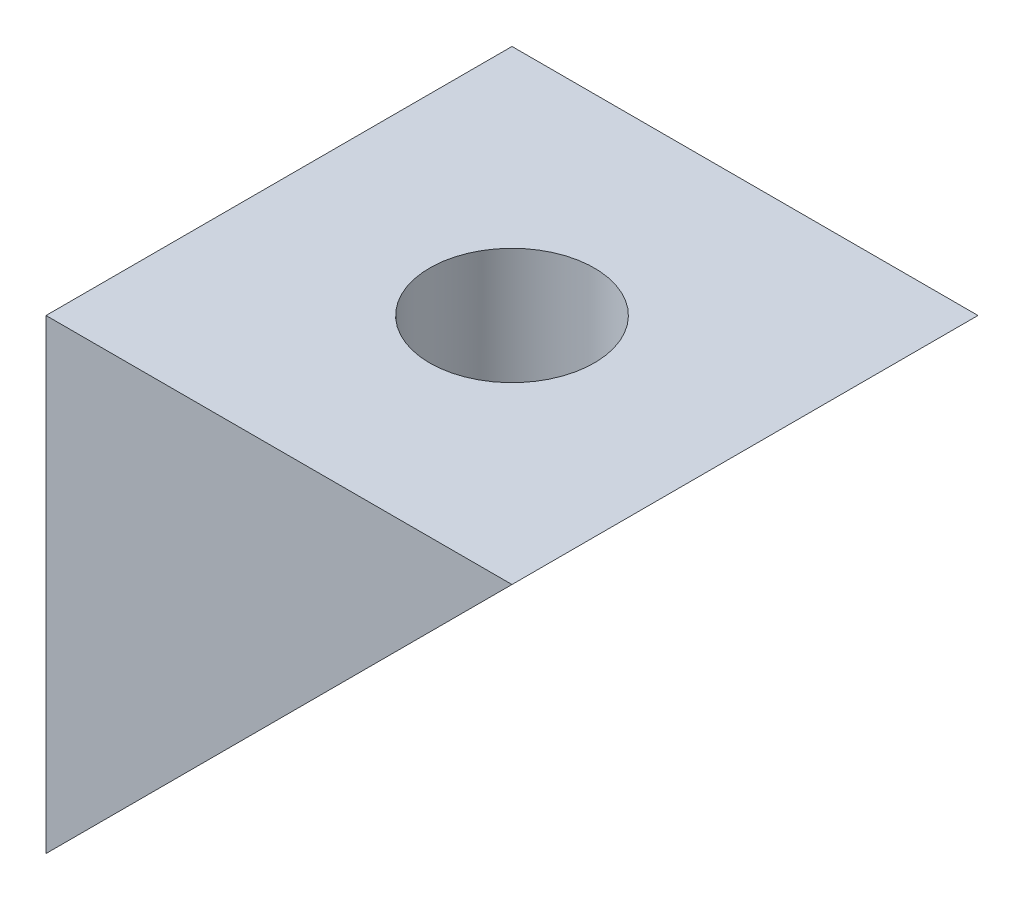
from build123d import *

# Parameters (mm, degrees)
BOSS_EXTRU_1_DEPTH      = 12
ESQUISSE2_R             = 2.12
ENL_V_MAT_EXTRU_1_DEPTH = 12
ESQUISSE3_R             = 2.12
ENL_V_MAT_EXTRU_2_DEPTH = 12


with BuildPart() as part:
    # Esquisse1 → Boss.-Extru.1 (new body)
    with BuildSketch(Plane.XY):
        Polygon((0, 0), (0, 12), (12, 12), align=None)
    extrude(amount=BOSS_EXTRU_1_DEPTH)

    # Esquisse2 → Enlèv. mat.-Extru.1 (cut)
    with BuildSketch(Plane(origin=(0, 12, 0), x_dir=(1, 0, 0), z_dir=(0, 1, 0))):
        with Locations(Location((6, -6, 0), (0, 0, 270))):
            Circle(ESQUISSE2_R)
    extrude(amount=-ENL_V_MAT_EXTRU_1_DEPTH, mode=Mode.SUBTRACT)

    # Esquisse3 → Enlèv. mat.-Extru.2 (cut)
    with BuildSketch(Plane.ZY):
        with Locations((6, 6)):
            Circle(ESQUISSE3_R)
    extrude(amount=-ENL_V_MAT_EXTRU_2_DEPTH, mode=Mode.SUBTRACT)


solid = part.part
